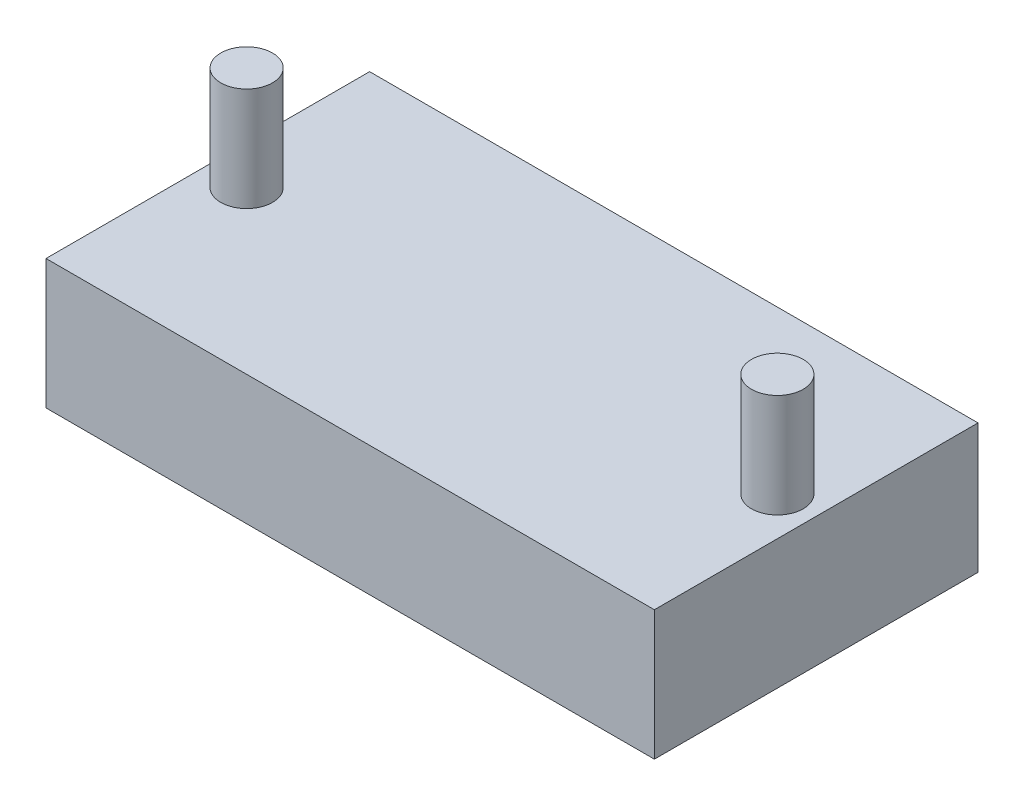
from build123d import *

# Parameters (mm, degrees)
SKETCH1_W           = 47
SKETCH1_H           = 25
BOSS_EXTRUDE1_DEPTH = 10
SKETCH2_R           = 2
BOSS_EXTRUDE2_DEPTH = 8


with BuildPart() as part:
    # Sketch1 → Boss-Extrude1 (new body)
    with BuildSketch(Plane(origin=(0, 0, 0), x_dir=(1, 0, 0), z_dir=(0, 1, 0))):
        with Locations((23.5, 12.5)):
            Rectangle(SKETCH1_W, SKETCH1_H)
    extrude(amount=BOSS_EXTRUDE1_DEPTH)

    # Sketch2 → Boss-Extrude2 (add)
    with BuildSketch(Plane(origin=(0, 10, 0), x_dir=(1, 0, 0), z_dir=(0, 1, 0))):
        with Locations(Location((3, 12.5, 0), (0, 0, 90))):
            Circle(SKETCH2_R)
        with Locations(Location((44, 12.5, 0), (0, 0, 90))):
            Circle(SKETCH2_R)
    extrude(amount=BOSS_EXTRUDE2_DEPTH)


solid = part.part
